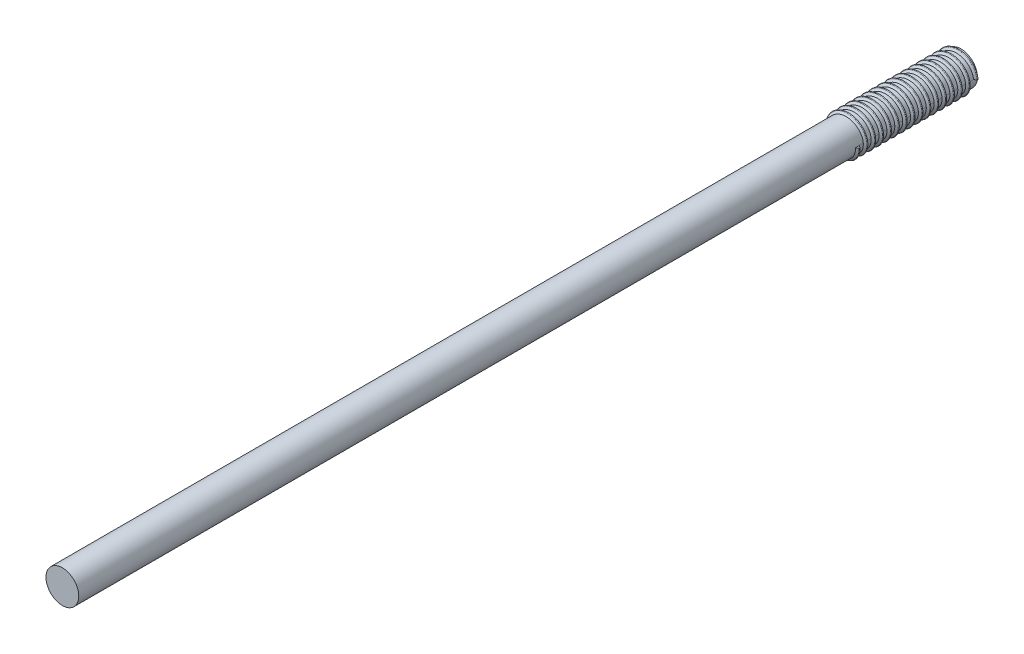
from build123d import *

# Parameters (mm, degrees)
EXTRUDE1_DEPTH      = 3.5
EXTRUDE1_DEPTH_BACK = 65
SKETCH1_R           = 1.25
SWEEP1_PITCH        = 0.6
SWEEP1_HEIGHT       = 9
SWEEP1_RADIUS       = 1.25


with BuildPart() as part:
    # Sketch1 → Extrude1 (new, two sides: drawn at the far end of the back side and taken through both)
    with BuildSketch(Plane.XY.offset(-EXTRUDE1_DEPTH_BACK)):
        Circle(SKETCH1_R)
    extrude(amount=EXTRUDE1_DEPTH + EXTRUDE1_DEPTH_BACK)

    # Sweep1: sweep along a helix
    with BuildLine() as sweep1_path:
        Helix(SWEEP1_PITCH, SWEEP1_HEIGHT, SWEEP1_RADIUS, center=(0, 0, -65), direction=(0, 0, 1))
    # Sketch3 → Sweep1 (sweep)
    with BuildSketch(Plane(origin=(0, 0, 0), x_dir=(1, 0, 0), z_dir=(0, 1, 0))):
        with BuildLine():
            Line((1.232630685, 65), (1.232630685, 64.68380068))
            Line((1.232630685, 64.68380068), (1.408682917, 64.794462083))
            ThreePointArc((1.408682917, 64.794462083), (1.432064184, 64.835786229), (1.410367235, 64.878019049))
            Line((1.410367235, 64.878019049), (1.232630685, 65))
        make_face()
    sweep(path=sweep1_path.line, is_frenet=True)


solid = part.part
